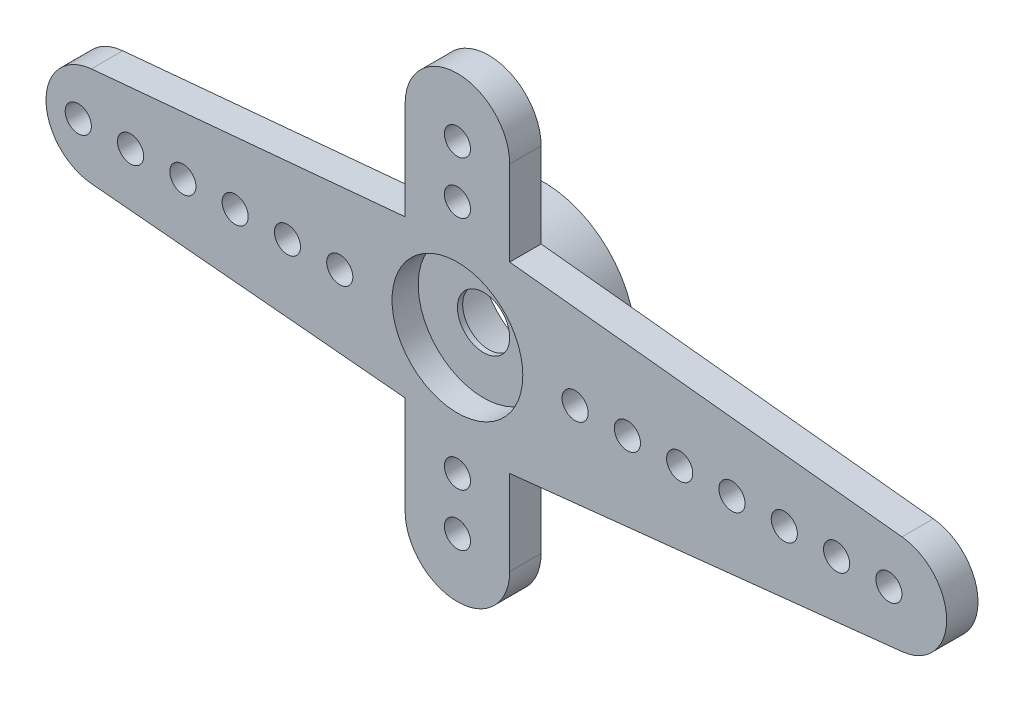
from build123d import *

# Parameters (mm, degrees)
BOSS_EXTRUDE1_DEPTH = 1.2
SKETCH2_R           = 3.5
BOSS_EXTRUDE2_DEPTH = 2.1
SKETCH3_R           = 2.5
CUT_EXTRUDE1_DEPTH  = 1
SKETCH4_R           = 1
CUT_EXTRUDE2_DEPTH  = 21.78090329
SKETCH6_R           = 2.45
CUT_EXTRUDE3_DEPTH  = 2.1
SKETCH7_R           = 0.5
CUT_EXTRUDE4_DEPTH  = 21.915208379
SKETCH8_R           = 0.5
CUT_EXTRUDE5_DEPTH  = 21.915208379


with BuildPart() as part:
    # Sketch1 → Boss-Extrude1 (new body)
    with BuildSketch(Plane.XY):
        with BuildLine():
            Line((-2, -6.75), (-2, -3))
            Line((-2, -3), (-14, -1.9))
            ThreePointArc((-14, -1.9), (-15.733799273, 0), (-14, 1.9))
            Line((-14, 1.9), (-2, 3))
            Line((-2, 3), (-2, 6.75))
            ThreePointArc((-2, 6.75), (0, 8.75), (2, 6.75))
            Line((2, 6.75), (2, 3.5))
            Line((2, 3.5), (17, 1.9))
            ThreePointArc((17, 1.9), (18.708111651, 0), (17, -1.9))
            Line((17, -1.9), (2, -3.5))
            Line((2, -3.5), (2, -6.75))
            ThreePointArc((2, -6.75), (0, -8.75), (-2, -6.75))
        make_face()
    extrude(amount=BOSS_EXTRUDE1_DEPTH)

    # Sketch2 → Boss-Extrude2 (add)
    with BuildSketch(Plane(origin=(0, 0, 0), x_dir=(-1, 0, 0), z_dir=(0, 0, -1))):
        Circle(SKETCH2_R)
    extrude(amount=BOSS_EXTRUDE2_DEPTH)

    # Sketch3 → Cut-Extrude1 (cut)
    with BuildSketch(Plane.XY.offset(1.2)):
        Circle(SKETCH3_R)
    extrude(amount=-CUT_EXTRUDE1_DEPTH, mode=Mode.SUBTRACT)

    # Sketch4 → Cut-Extrude2 (cut, through all)
    with BuildSketch(Plane.XY.offset(0.2)):
        Circle(SKETCH4_R)
    extrude(amount=-CUT_EXTRUDE2_DEPTH, mode=Mode.SUBTRACT)

    # Sketch6 → Cut-Extrude3 (cut)
    with BuildSketch(Plane(origin=(0, 0, -2.1), x_dir=(-1, 0, 0), z_dir=(0, 0, -1))):
        Circle(SKETCH6_R)
    extrude(amount=-CUT_EXTRUDE3_DEPTH, mode=Mode.SUBTRACT)

    # Sketch7 → Cut-Extrude4 (cut, through all)
    with BuildSketch(Plane.XY.offset(1.2)):
        with Locations((0, -4.5)):
            Circle(SKETCH7_R)
        with Locations((0, -6.5)):
            Circle(SKETCH7_R)
        with Locations((0, 4.5)):
            Circle(SKETCH7_R)
        with Locations((0, 6.5)):
            Circle(SKETCH7_R)
    extrude(amount=-CUT_EXTRUDE4_DEPTH, mode=Mode.SUBTRACT)

    # Sketch8 → Cut-Extrude5 (cut, through all)
    with BuildSketch(Plane.XY.offset(1.2)):
        with Locations((-4.5, 0)):
            Circle(SKETCH8_R)
        with Locations((-6.5, 0)):
            Circle(SKETCH8_R)
        with Locations((-8.5, 0)):
            Circle(SKETCH8_R)
        with Locations((-10.5, 0)):
            Circle(SKETCH8_R)
        with Locations((-12.5, 0)):
            Circle(SKETCH8_R)
        with Locations((-14.5, 0)):
            Circle(SKETCH8_R)
        with Locations(Location((4.5, 0, 0), (0, 0, 180))):
            Circle(SKETCH8_R)
        with Locations(Location((6.5, 0, 0), (0, 0, 180))):
            Circle(SKETCH8_R)
        with Locations(Location((8.5, 0, 0), (0, 0, 180))):
            Circle(SKETCH8_R)
        with Locations(Location((10.5, 0, 0), (0, 0, 180))):
            Circle(SKETCH8_R)
        with Locations(Location((12.5, 0, 0), (0, 0, 180))):
            Circle(SKETCH8_R)
        with Locations(Location((14.5, 0, 0), (0, 0, 180))):
            Circle(SKETCH8_R)
        with Locations((16.5, 0)):
            Circle(SKETCH8_R)
    extrude(amount=-CUT_EXTRUDE5_DEPTH, mode=Mode.SUBTRACT)


solid = part.part
